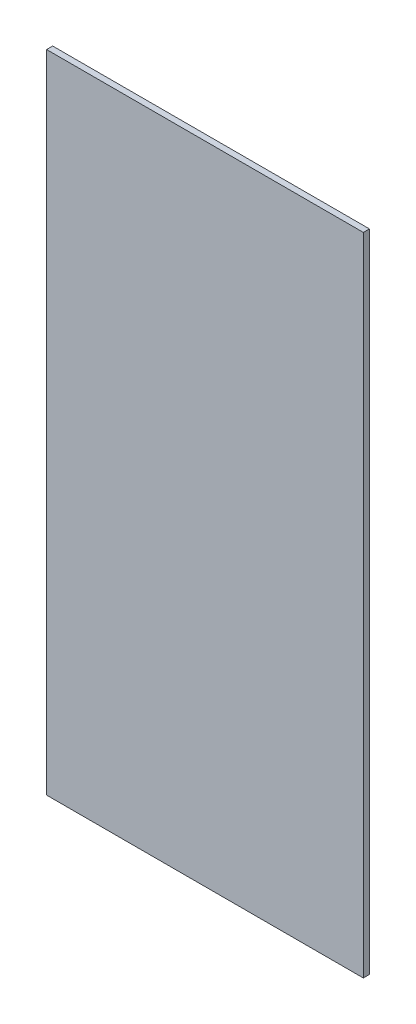
from build123d import *

# Parameters (mm, degrees)
ESQUISSE1_W        = 156
ESQUISSE1_H        = 318
BOSS_EXTRU_1_DEPTH = 3


with BuildPart() as part:
    # Esquisse1 → Boss.-Extru.1 (new body)
    with BuildSketch(Plane.XY):
        with Locations((78.917030568, 37.493449782)):
            Rectangle(ESQUISSE1_W, ESQUISSE1_H)
    extrude(amount=BOSS_EXTRU_1_DEPTH)


solid = part.part
